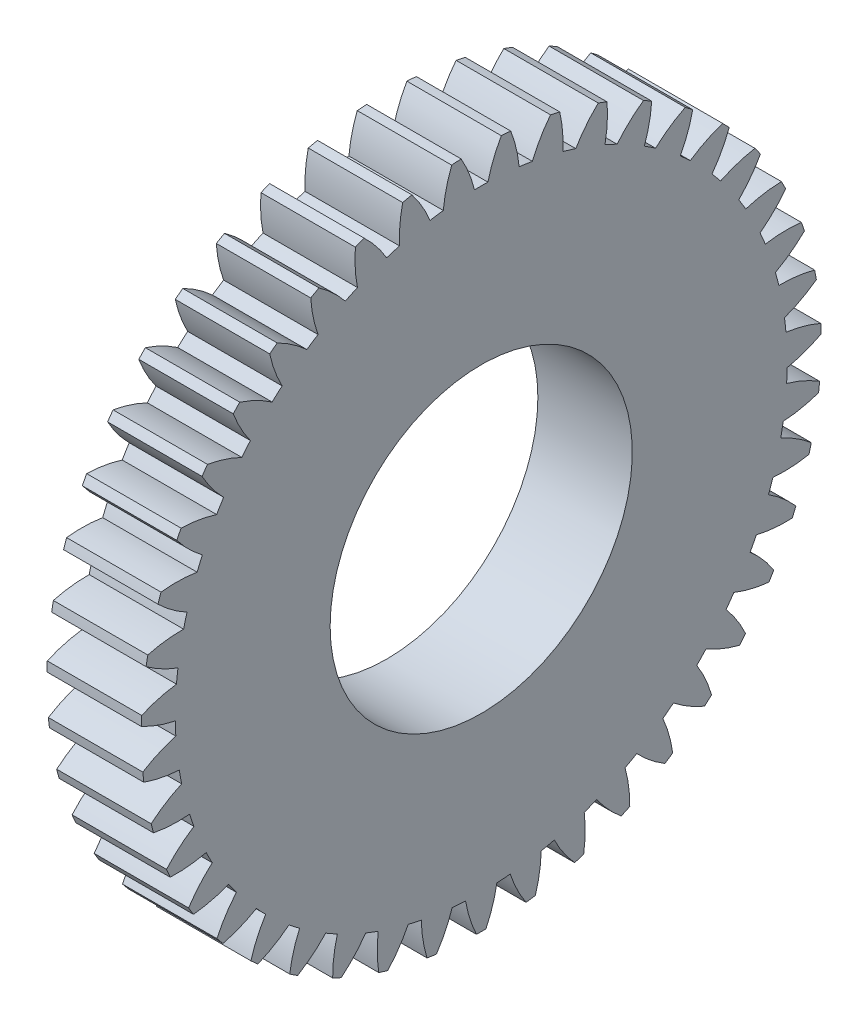
from build123d import *

# Parameters (mm, degrees)
BASPROSKE_W     = 2.5
BASPROSKE_H     = 9
TOOTHCUT_DEPTH  = 13.971121771
TEETHCUTS_COUNT = 43
TEETHCUTS_ANGLE = 351.627906977
BORSKE_R        = 4
BORE_DEPTH      = 50.0000508


with BuildPart() as part:
    # BasProSke → Base-Revolve (revolve)
    with BuildSketch(Plane(origin=(0, 0, 0), x_dir=(1, 0, 0), z_dir=(0, 1, 0)), mode=Mode.PRIVATE) as base_revolve_sk:
        with Locations((1.25, 4.5)):
            Rectangle(BASPROSKE_W, BASPROSKE_H)
    revolve(base_revolve_sk.sketch.rotate(Axis((-10, 0, 0), (1, 0, 0)), 180), axis=Axis((-10, 0, 0), (1, 0, 0)))

    # TooCutSke → ToothCut (cut, through all)
    with BuildSketch(Plane(origin=(0, 0, 0), x_dir=(0, 0, -1), z_dir=(1, 0, 0))):
        with BuildLine():
            ThreePointArc((0.177469936, 8.097055355), (0, 8.099), (-0.177469936, 8.097055355))
            ThreePointArc((-0.177469936, 8.097055355), (-0.329249996, 8.566205856), (-0.546546154, 9.008836354))
            ThreePointArc((-0.546546154, 9.008836354), (0, 9.0254), (0.546546154, 9.008836354))
            ThreePointArc((0.546546154, 9.008836354), (0.329249996, 8.566205856), (0.177469936, 8.097055355))
        make_face()
    toothcut = extrude(amount=TOOTHCUT_DEPTH, mode=Mode.SUBTRACT)

    # TeethCuts: ToothCut ×43 about axis
    teethcuts_axis = Axis((-10, 0, 0), (1, 0, 0))
    for i in range(1, TEETHCUTS_COUNT):
        add(toothcut.rotate(teethcuts_axis, i * TEETHCUTS_ANGLE / (TEETHCUTS_COUNT - 1)), mode=Mode.SUBTRACT)

    # BorSke → Bore (cut, symmetric)
    with BuildSketch(Plane(origin=(0, 0, 0), x_dir=(0, 0, -1), z_dir=(1, 0, 0))):
        with Locations(Location((0, 0, 0), (0, 0, 180))):
            Circle(BORSKE_R)
    extrude(amount=BORE_DEPTH, both=True, mode=Mode.SUBTRACT)


solid = part.part
